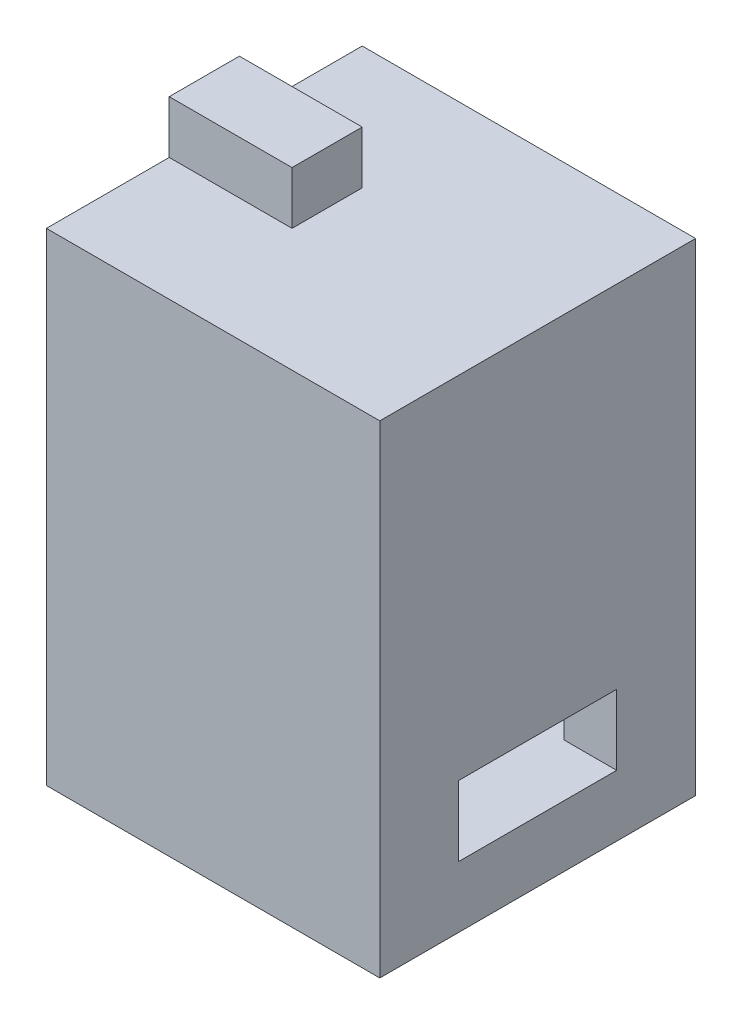
from build123d import *

# Parameters (mm, degrees)
BOSS_EXTRUDE1_DEPTH = 19
SKETCH3_W           = 4.925645198
SKETCH3_H           = 33.799871634
BOSS_EXTRUDE2_DEPTH = 19
SKETCH4_W           = 4.925645198
SKETCH4_H           = 7.649871634
CUT_EXTRUDE1_DEPTH  = 41.8379487
SKETCH5_W           = 10.925645198
SKETCH5_H           = 26.15
CUT_EXTRUDE3_DEPTH  = 37.834770316
SKETCH6_W           = 24.5
SKETCH6_H           = 6.25
BOSS_EXTRUDE3_DEPTH = 19
SKETCH7_W           = 18
SKETCH7_H           = 64
BOSS_EXTRUDE4_DEPTH = 19
BOSS_EXTRUDE5_DEPTH = 19
SKETCH10_W          = 12.5
SKETCH10_H          = 22.9
CUT_EXTRUDE4_DEPTH  = 16
SKETCH11_W          = 4
SKETCH11_H          = 3
BOSS_EXTRUDE6_DEPTH = 7
SKETCH12_R          = 0.9375
CUT_EXTRUDE5_DEPTH  = 6.5
BOSS_EXTRUDE7_DEPTH = 19
CUT_EXTRUDE6_DEPTH  = 102.016783878
CUT_EXTRUDE7_DEPTH  = 102.016783878
CUT_EXTRUDE8_DEPTH  = 102.016783878
SKETCH20_W          = 9.2
SKETCH20_H          = 10.4
CUT_EXTRUDE10_DEPTH = 102.016783878
SKETCH21_W          = 5
SKETCH21_H          = 22
BOSS_EXTRUDE8_DEPTH = 19
CUT_EXTRUDE11_DEPTH = 102.016783878
CUT_EXTRUDE12_DEPTH = 102.016783878
SKETCH24_W          = 9
SKETCH24_H          = 4
CUT_EXTRUDE13_DEPTH = 10


with BuildPart() as part:
    # Sketch2 → Boss-Extrude1 (new body)
    with BuildSketch(Plane(origin=(0, 0, 0), x_dir=(0, 0, -1), z_dir=(1, 0, 0))):
        Polygon((-4.2, 3.125), (-14.2, 3.125), (-14.2, -3.125), (-4.2, -3.125), (-4.2, -5.2), (-2.4, -5.2), (0, -2.8), (0, 2.8), (-2.4, 5.2), (-4.2, 5.2), align=None)
    boss_extrude1 = extrude(amount=BOSS_EXTRUDE1_DEPTH)

    # Sketch3 → Boss-Extrude2 (add)
    with BuildSketch(Plane.ZY):
        with Locations((16.662822599, 13.774935817)):
            Rectangle(SKETCH3_W, SKETCH3_H)
    extrude(amount=-BOSS_EXTRUDE2_DEPTH)

    # Mirror2: Boss-Extrude1 across plane
    add(boss_extrude1.mirror(Plane.ZX.offset(9.95)))

    # Sketch4 → Cut-Extrude1 (cut, through all)
    with BuildSketch(Plane.ZY):
        with Locations((16.662822599, 26.849935817)):
            Rectangle(SKETCH4_W, SKETCH4_H)
    extrude(amount=-CUT_EXTRUDE1_DEPTH, mode=Mode.SUBTRACT)

    # Sketch5 → Cut-Extrude3 (cut, through all)
    with BuildSketch(Plane(origin=(19, 0, 0), x_dir=(0, 0, -1), z_dir=(1, 0, 0))):
        with Locations((-13.662822599, 9.95)):
            Rectangle(SKETCH5_W, SKETCH5_H)
    extrude(amount=-CUT_EXTRUDE3_DEPTH, mode=Mode.SUBTRACT)


with BuildPart() as cut_extrude3_piece_1:
    # of the separate pieces the step leaves, piece 1, a body of its own (cut_extrude3_pieces)
    add(part.part.solids().sort_by_distance((0, 16.775, 8.2))[0])



with BuildPart() as cut_extrude3_piece_2:
    # of the separate pieces the step leaves, piece 2, a body of its own (cut_extrude3_pieces)
    add(part.part.solids().sort_by_distance((0, 3.125, 4.2))[0])


with BuildPart() as cut_extrude3_piece_1_1:
    add(cut_extrude3_piece_1.part)

    add(cut_extrude3_piece_2.part)  # Boss-Extrude3 merges Cut-Extrude3 piece 2
    # Sketch6 → Boss-Extrude3 (add)
    with BuildSketch(Plane(origin=(19, 0, 0), x_dir=(0, 0, -1), z_dir=(1, 0, 0))):
        Polygon((-25.005276382, 16.775), (-32.7, 16.775), (-8.2, -3.125), (-8.2, 3.125), align=None)
        with Locations((-20.45, 19.9)):
            Rectangle(SKETCH6_W, SKETCH6_H)
    extrude(amount=-BOSS_EXTRUDE3_DEPTH)

    # Sketch7 → Boss-Extrude4 (add)
    with BuildSketch(Plane.ZY):
        with Locations((32.7, 55.025)):
            Rectangle(SKETCH7_W, SKETCH7_H)
    extrude(amount=-BOSS_EXTRUDE4_DEPTH)

    # Sketch9 → Boss-Extrude5 (add)
    with BuildSketch(Plane.ZY):
        Polygon((41.7, 23.025), (32.7, 23.025), (32.7, 16.775), align=None)
    extrude(amount=-BOSS_EXTRUDE5_DEPTH)

    # Sketch10 → Cut-Extrude4 (cut)
    with BuildSketch(Plane.ZY):
        with Locations((32.7, 74.475)):
            Rectangle(SKETCH10_W, SKETCH10_H)
    extrude(amount=-CUT_EXTRUDE4_DEPTH, mode=Mode.SUBTRACT)

    # Sketch11 → Boss-Extrude6 (add)
    with BuildSketch(Plane.ZY):
        with Locations((32.7, 88.525)):
            Rectangle(SKETCH11_W, SKETCH11_H)
    extrude(amount=-BOSS_EXTRUDE6_DEPTH)

    # Sketch12 → Cut-Extrude5 (cut)
    with BuildSketch(Plane.ZY):
        with Locations((32.7, 87.925)):
            Circle(SKETCH12_R)
        with Locations((32.7, 61.025)):
            Circle(SKETCH12_R)
    extrude(amount=-CUT_EXTRUDE5_DEPTH, mode=Mode.SUBTRACT)

    # Sketch13 → Boss-Extrude7 (add)
    with BuildSketch(Plane.ZY):
        Polygon((9.2, 16.775), (9.2, 3.937244898), (25.005276382, 16.775), align=None)
    extrude(amount=-BOSS_EXTRUDE7_DEPTH)

    # Sketch14 → Cut-Extrude6 (cut, through all)
    with BuildSketch(Plane.ZY):
        Polygon((23.7, 59.525), (28.7, 52.275), (28.7, 30.275), (23.7, 23.025), align=None)
        Polygon((36.7, 30.275), (41.7, 23.025), (41.7, 59.525), (36.7, 52.275), align=None)
    extrude(amount=-CUT_EXTRUDE6_DEPTH, mode=Mode.SUBTRACT)

    # Sketch16 → Cut-Extrude7 (cut, through all)
    with BuildSketch(Plane(origin=(19, 0, 0), x_dir=(0, 0, -1), z_dir=(1, 0, 0))):
        Polygon((-8.2, -3.125), (-41.231348669, 23.704544429), (-41.7, 23.025), align=None)
    extrude(amount=-CUT_EXTRUDE7_DEPTH, mode=Mode.SUBTRACT)

    # Sketch17 → Cut-Extrude8 (cut, through all)
    with BuildSketch(Plane.ZY):
        Polygon((36.7, 30.275), (36.7, 20.023979592), (41.231348669, 23.704544429), align=None)
    extrude(amount=-CUT_EXTRUDE8_DEPTH, mode=Mode.SUBTRACT)

    # Sketch20 → Cut-Extrude10 (cut, through all)
    with BuildSketch(Plane.ZY):
        Polygon((36.7, 16.775), (9.2, 16.775), (9.2, 5.2), (9.2, -5.2), (36.7, -5.2), align=None)
        with Locations((4.6, 0)):
            Rectangle(SKETCH20_W, SKETCH20_H)
    extrude(amount=-CUT_EXTRUDE10_DEPTH, mode=Mode.SUBTRACT)

    # Sketch21 → Boss-Extrude8 (add, through all)
    with BuildSketch(Plane.ZY):
        with Locations((8.8, 5.775)):
            Rectangle(SKETCH21_W, SKETCH21_H)
    extrude(amount=-BOSS_EXTRUDE8_DEPTH)

    # Sketch22 → Cut-Extrude11 (cut, through all)
    with BuildSketch(Plane.ZY):
        Polygon((32.7, 16.775), (36.7, 22.575), (36.7, 20.023979592), align=None)
    extrude(amount=-CUT_EXTRUDE11_DEPTH, mode=Mode.SUBTRACT)

    # Sketch23 → Cut-Extrude12 (cut, through all)
    with BuildSketch(Plane.ZY):
        Polygon((23.7, 59.525), (41.7, 59.525), (41.7, -5.225), (6.3, -5.225), (0, 17.1), (0, 22.7), (2.4, 25.1), align=None)
    extrude(amount=-CUT_EXTRUDE12_DEPTH, mode=Mode.SUBTRACT)

    # Sketch24 → Cut-Extrude13 (cut)
    with BuildSketch(Plane.ZY.offset(-16)):
        with Locations((32.7, 65.025)):
            Rectangle(SKETCH24_W, SKETCH24_H)
    extrude(amount=-CUT_EXTRUDE13_DEPTH, mode=Mode.SUBTRACT)


solid = cut_extrude3_piece_1_1.part
